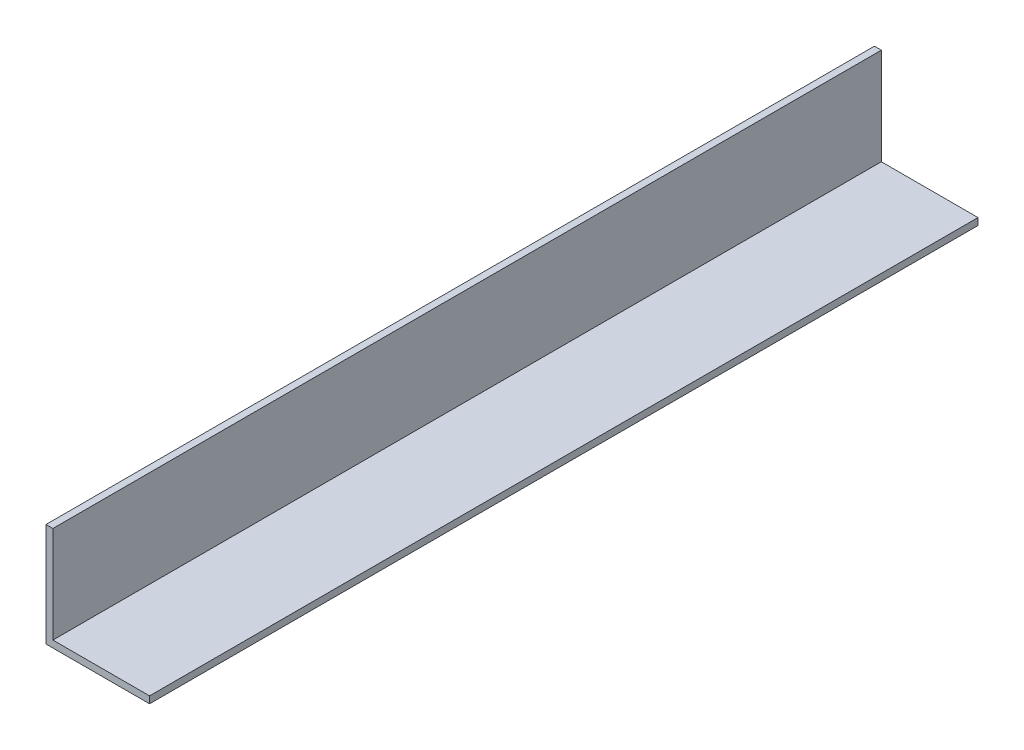
from build123d import *

# Parameters (mm, degrees)
EXTRUDE_1_DEPTH = 240


with BuildPart() as part:
    # Эскиз1 → Бобышка-Вытянуть1 (new body)
    with BuildSketch(Plane.XY):
        Polygon((0, 0), (30, 0), (30, 2), (2, 2), (2, 30), (0, 30), align=None)
    extrude(amount=EXTRUDE_1_DEPTH)


solid = part.part
